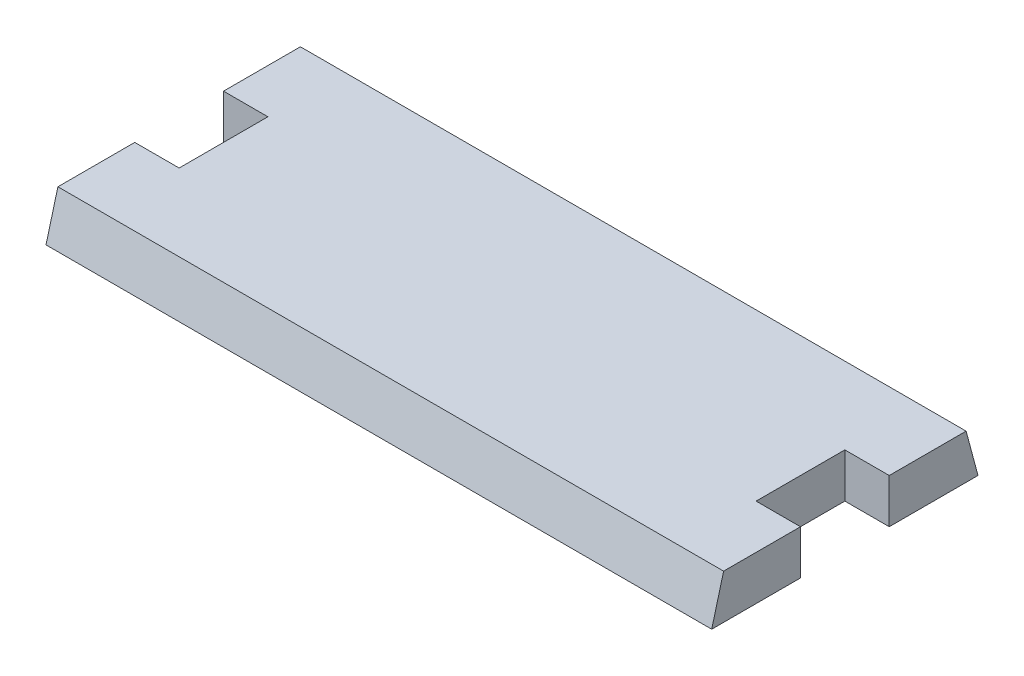
from build123d import *

# Parameters (mm, degrees)
BOSS_EXTRUDE1_DEPTH = 10
DRAFT1_ANGLE        = -15


with BuildPart() as part:
    # Sketch1 → Boss-Extrude1 (new body)
    with BuildSketch(Plane(origin=(0, 0, 0), x_dir=(1, 0, 0), z_dir=(0, 1, 0))):
        Polygon((-75, 30), (75, 30), (75, 10), (65, 10), (65, -10), (75, -10), (75, -30), (-75, -30), (-75, -10), (-65, -10), (-65, 10), (-75, 10), align=None)
    extrude(amount=BOSS_EXTRUDE1_DEPTH)

    # Draft1
    draft1_faces = [part.faces().sort_by_distance(p)[0] for p in [
        (0, 5, -30),
        (0, 5, 30),
    ]]
    draft(draft1_faces, Plane(origin=(0, 0, 0), x_dir=(0, 0, -1), z_dir=(0, -1, 0)), DRAFT1_ANGLE)


solid = part.part
